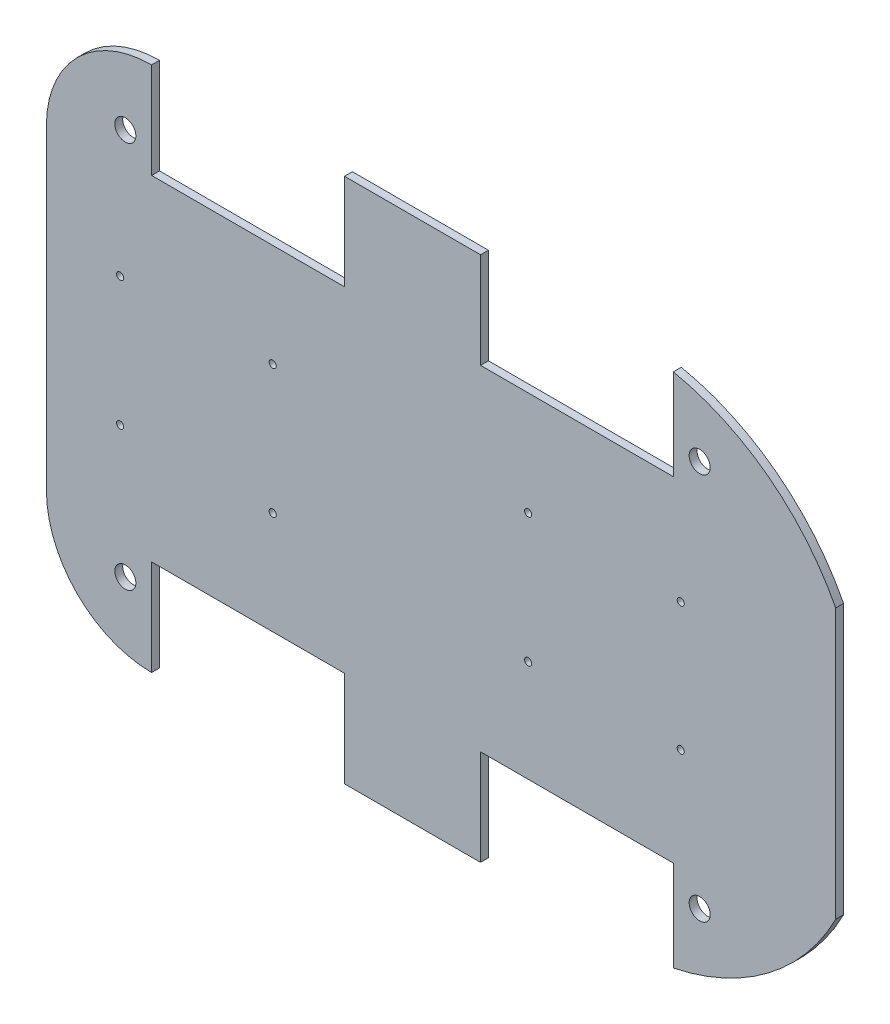
from build123d import *

# Parameters (mm, degrees)
SKETCH_1_R          = 2
SKETCH_1_W          = 15
SKETCH_1_H          = 3
EXTRUDE_1_DEPTH     = 3
CUT_EXTRUDE_1_REACH = 360.482
SKETCH_2_W          = 15
SKETCH_2_H          = 3
SKETCH_3_R          = 2
EXTRUDE_2_DEPTH     = 3
SKETCH_4_W          = 15
SKETCH_4_H          = 3
CUT_EXTRUDE_2_DEPTH = 10
EXTRUDE_START       = -3
EXTRUDE_3_DEPTH     = 3
SKETCH_10_R         = 4
CUT_EXTRUDE_3_DEPTH = 3
SKETCH_11_R         = 1.35
CUT_EXTRUDE_4_DEPTH = 3
EXTRUDE_START_2     = 4
SKETCH_12_R         = 4
SKETCH_12_R_2       = 1.35
EXTRUDE_4_DEPTH     = 4
SKETCH_13_R         = 1.35
CUT_EXTRUDE_5_DEPTH = 3
SKETCH_14_R         = 4
SKETCH_14_R_2       = 1.35
EXTRUDE_5_DEPTH     = 4
CUT_EXTRUDE_START   = -4
CUT_EXTRUDE_6_DEPTH = 4


with BuildPart() as part:
    # 草图1 → 凸台-拉伸1 (new body)
    with BuildSketch(Plane.XY.offset(3)):
        with BuildLine():
            Line((165, 0), (165, 28))
            Line((165, 28), (173, 28))
            Line((173, 28), (173, 31.7))
            Line((173, 31.7), (188, 31.7))
            Line((188, 31.7), (188, 28))
            Line((188, 28), (238.3, 28))
            Line((238.3, 28), (238.3, 1.880138448))
            ThreePointArc((238.3, 1.880138448), (310, 90), (238.3, 178.119861552))
            Line((238.3, 178.119861552), (238.3, 152))
            Line((238.3, 152), (188, 152))
            Line((188, 152), (188, 148.3))
            Line((188, 148.3), (173, 148.3))
            Line((173, 148.3), (173, 152))
            Line((173, 152), (165, 152))
            Line((165, 152), (165, 180))
            Line((165, 180), (113.3, 180))
            Line((113.3, 180), (113.3, 152))
            Line((113.3, 152), (63, 152))
            Line((63, 152), (63, 148.3))
            Line((63, 148.3), (48, 148.3))
            Line((48, 148.3), (48, 152))
            Line((48, 152), (40, 152))
            Line((40, 152), (40, 180))
            ThreePointArc((40, 180), (11.715728753, 168.284271247), (0, 140))
            Line((0, 140), (0, 40))
            ThreePointArc((0, 40), (11.715728753, 11.715728753), (40, 0))
            Line((40, 0), (40, 28))
            Line((40, 28), (48, 28))
            Line((48, 28), (48, 31.7))
            Line((48, 31.7), (63, 31.7))
            Line((63, 31.7), (63, 28))
            Line((63, 28), (113.3, 28))
            Line((113.3, 28), (113.3, 0))
            Line((113.3, 0), (165, 0))
        make_face()
        with Locations(Location((233.9, 84.9, 0), (0, 0, 180))):
            Circle(SKETCH_1_R, mode=Mode.SUBTRACT)
        with Locations(Location((186.1, 84.9, 0), (0, 0, 180))):
            Circle(SKETCH_1_R, mode=Mode.SUBTRACT)
        with Locations(Location((28, 166, 0), (0, 0, 180))):
            Circle(SKETCH_1_R, mode=Mode.SUBTRACT)
        with Locations(Location((28, 14, 0), (0, 0, 180))):
            Circle(SKETCH_1_R, mode=Mode.SUBTRACT)
        with Locations(Location((248.3, 165.059930776, 0), (0, 0, 180))):
            Circle(SKETCH_1_R, mode=Mode.SUBTRACT)
        with Locations(Location((248.3, 14.940069224, 0), (0, 0, 180))):
            Circle(SKETCH_1_R, mode=Mode.SUBTRACT)
        with Locations(Location((139.15, 14, 0), (0, 0, 180))):
            Circle(SKETCH_1_R, mode=Mode.SUBTRACT)
        with Locations(Location((139.15, 166, 0), (0, 0, 180))):
            Circle(SKETCH_1_R, mode=Mode.SUBTRACT)
        with Locations((55.5, 52)):
            Rectangle(SKETCH_1_W, SKETCH_1_H, mode=Mode.SUBTRACT)
        with Locations((180.5, 52)):
            Rectangle(SKETCH_1_W, SKETCH_1_H, mode=Mode.SUBTRACT)
        with Locations((180.5, 128)):
            Rectangle(SKETCH_1_W, SKETCH_1_H, mode=Mode.SUBTRACT)
        with Locations((55.5, 128)):
            Rectangle(SKETCH_1_W, SKETCH_1_H, mode=Mode.SUBTRACT)
    extrude(amount=-EXTRUDE_1_DEPTH)

    # 草图2 → 切除-拉伸1 (cut, up to next)
    with BuildSketch(Plane(origin=(0, 0, 0), x_dir=(-1, 0, 0), z_dir=(0, 0, -1)), mode=Mode.PRIVATE) as cut_extrude_1_sk1:
        with Locations((-55.280073226, 119.6)):
            Rectangle(SKETCH_2_W, SKETCH_2_H)
    cut_extrude_1_tool1 = extrude(cut_extrude_1_sk1.sketch, amount=-CUT_EXTRUDE_1_REACH, mode=Mode.PRIVATE) & part.part
    # 草图2 → 切除-拉伸1 (cut, up to next)
    with BuildSketch(Plane(origin=(0, 0, 0), x_dir=(-1, 0, 0), z_dir=(0, 0, -1)), mode=Mode.PRIVATE) as cut_extrude_1_sk2:
        Polygon((-48, 152), (-40, 152), (-40, 143.6), (-48, 143.6), (-48, 139.9), (-63, 139.9), (-63, 143.6), (-113.3, 143.6), (-113.3, 152), (-63, 152), (-63, 148.3), (-48, 148.3), align=None)
    cut_extrude_1_tool2 = extrude(cut_extrude_1_sk2.sketch, amount=-CUT_EXTRUDE_1_REACH, mode=Mode.PRIVATE) & part.part
    add(cut_extrude_1_tool1.solids().sort_by_distance((55.280073, 119.6, 0))[0], mode=Mode.SUBTRACT)
    add(cut_extrude_1_tool2.solids().sort_by_distance((76.65, 147.042838, 0))[0], mode=Mode.SUBTRACT)

    # 草图3 → 凸台-拉伸2 (add)
    with BuildSketch(Plane.XY.offset(3)):
        with Locations((186.1, 84.9)):
            Circle(SKETCH_3_R)
        with Locations((233.9, 84.9)):
            Circle(SKETCH_3_R)
    extrude(amount=-EXTRUDE_2_DEPTH)

    # 草图4 → 切除-拉伸2 (cut)
    with BuildSketch(Plane(origin=(0, 0, 0), x_dir=(-1, 0, 0), z_dir=(0, 0, -1))):
        with Locations((-180.685567248, 119.6)):
            Rectangle(SKETCH_4_W, SKETCH_4_H)
        Polygon((-238.3, 143.6), (-188, 143.6), (-188, 139.9), (-173, 139.9), (-173, 143.6), (-165, 143.6), (-165, 152), (-173, 152), (-173, 148.3), (-188, 148.3), (-188, 152), (-238.3, 152), align=None)
    extrude(amount=-CUT_EXTRUDE_2_DEPTH, mode=Mode.SUBTRACT)

    # Split Bodies 4
    split(bisect_by=Plane.ZX.offset(90), keep=Keep.TOP)

    # 草图9 → 凸台-拉伸3 (add)
    with BuildSketch(Plane(origin=(0, 0, 0), x_dir=(-1, 0, 0), z_dir=(0, 0, -1)).offset(EXTRUDE_START)):
        with BuildLine():
            Line((-310, 80), (0, 80))
            Line((0, 80), (0, 140))
            ThreePointArc((0, 140), (-11.715728753, 168.284271247), (-40, 180))
            Line((-40, 180), (-40, 143.6))
            Line((-40, 143.6), (-113.3, 143.6))
            Line((-113.3, 143.6), (-113.3, 180))
            Line((-113.3, 180), (-165, 180))
            Line((-165, 180), (-165, 143.6))
            Line((-165, 143.6), (-238.3, 143.6))
            Line((-238.3, 143.6), (-238.3, 178.119861552))
            ThreePointArc((-238.3, 178.119861552), (-289.810457669, 146.802288686), (-310, 90))
            Line((-310, 90), (-310, 80))
        make_face()
    extrude(amount=EXTRUDE_3_DEPTH)

    # 草图10 → 切除-拉伸3 (cut)
    with BuildSketch(Plane(origin=(0, 0, 0), x_dir=(-1, 0, 0), z_dir=(0, 0, -1))):
        with Locations((-248.3, 153.6)):
            Circle(SKETCH_10_R)
        with Locations((-30, 153.6)):
            Circle(SKETCH_10_R)
    extrude(amount=-CUT_EXTRUDE_3_DEPTH, mode=Mode.SUBTRACT)

    # 镜向2: part across plane


with BuildPart() as part_1:
    add(part.part)
    add(part.part.mirror(Plane(origin=(310, 80, 328.729949498), x_dir=(0, 0, 1), z_dir=(0, -1, 0))))

    # 草图11 → 切除-拉伸4 (cut)
    with BuildSketch(Plane(origin=(0, 0, 0), x_dir=(-1, 0, 0), z_dir=(0, 0, -1))):
        with Locations((-86.022725282, 104.5)):
            Circle(SKETCH_11_R)
        with Locations((-86.022725282, 55.5)):
            Circle(SKETCH_11_R)
        with Locations((-28.022725282, 104.5)):
            Circle(SKETCH_11_R)
        with Locations((-28.022725282, 55.5)):
            Circle(SKETCH_11_R)
    extrude(amount=-CUT_EXTRUDE_4_DEPTH, mode=Mode.SUBTRACT)

    # 草图12 → 凸台-拉伸4 (add)
    # profile 1 of 4: a face of its own
    with BuildSketch(Plane(origin=(0, 0, 0), x_dir=(-1, 0, 0), z_dir=(0, 0, -1)).offset(EXTRUDE_START_2)):
        with Locations(Location((-86.022725282, 104.5, 0), (0, 0, 180))):
            Circle(SKETCH_12_R)
        with Locations((-86.022725282, 104.5)):
            Circle(SKETCH_12_R_2, mode=Mode.SUBTRACT)
    # profile 2 of 4: a face of its own
    with BuildSketch(Plane(origin=(0, 0, 0), x_dir=(-1, 0, 0), z_dir=(0, 0, -1)).offset(EXTRUDE_START_2)):
        with Locations(Location((-28.022725282, 104.5, 0), (0, 0, 180))):
            Circle(SKETCH_12_R)
        with Locations((-28.022725282, 104.5)):
            Circle(SKETCH_12_R_2, mode=Mode.SUBTRACT)
    # profile 3 of 4: a face of its own
    with BuildSketch(Plane(origin=(0, 0, 0), x_dir=(-1, 0, 0), z_dir=(0, 0, -1)).offset(EXTRUDE_START_2)):
        with Locations(Location((-28.022725282, 55.5, 0), (0, 0, 180))):
            Circle(SKETCH_12_R)
        with Locations((-28.022725282, 55.5)):
            Circle(SKETCH_12_R_2, mode=Mode.SUBTRACT)
    # profile 4 of 4: a face of its own
    with BuildSketch(Plane(origin=(0, 0, 0), x_dir=(-1, 0, 0), z_dir=(0, 0, -1)).offset(EXTRUDE_START_2)):
        with Locations(Location((-86.022725282, 55.5, 0), (0, 0, 180))):
            Circle(SKETCH_12_R)
        with Locations((-86.022725282, 55.5)):
            Circle(SKETCH_12_R_2, mode=Mode.SUBTRACT)
    extrude(amount=-EXTRUDE_4_DEPTH)

    # 草图13 → 切除-拉伸5 (cut)
    with BuildSketch(Plane(origin=(0, 0, 0), x_dir=(-1, 0, 0), z_dir=(0, 0, -1))):
        with Locations((-183.092928671, 55.103896104)):
            Circle(SKETCH_13_R)
        with Locations((-183.092928671, 104.103896104)):
            Circle(SKETCH_13_R)
        with Locations((-241.09213252, 103.8)):
            Circle(SKETCH_13_R)
        with Locations((-241.092928671, 55.103896104)):
            Circle(SKETCH_13_R)
    extrude(amount=-CUT_EXTRUDE_5_DEPTH, mode=Mode.SUBTRACT)

    # 草图14 → 凸台-拉伸5 (add)
    # profile 1 of 4: a face of its own
    with BuildSketch(Plane(origin=(0, 0, 0), x_dir=(-1, 0, 0), z_dir=(0, 0, -1)).offset(EXTRUDE_START_2)):
        with Locations(Location((-241.09213252, 103.8, 0), (0, 0, 180))):
            Circle(SKETCH_14_R)
        with Locations((-241.09213252, 103.8)):
            Circle(SKETCH_14_R_2, mode=Mode.SUBTRACT)
    # profile 2 of 4: a face of its own
    with BuildSketch(Plane(origin=(0, 0, 0), x_dir=(-1, 0, 0), z_dir=(0, 0, -1)).offset(EXTRUDE_START_2)):
        with Locations(Location((-183.092928671, 104.103896104, 0), (0, 0, 180))):
            Circle(SKETCH_14_R)
        with Locations((-183.092928671, 104.103896104)):
            Circle(SKETCH_14_R_2, mode=Mode.SUBTRACT)
    # profile 3 of 4: a face of its own
    with BuildSketch(Plane(origin=(0, 0, 0), x_dir=(-1, 0, 0), z_dir=(0, 0, -1)).offset(EXTRUDE_START_2)):
        with Locations(Location((-241.092928671, 55.103896104, 0), (0, 0, 180))):
            Circle(SKETCH_14_R)
        with Locations((-241.092928671, 55.103896104)):
            Circle(SKETCH_14_R_2, mode=Mode.SUBTRACT)
    # profile 4 of 4: a face of its own
    with BuildSketch(Plane(origin=(0, 0, 0), x_dir=(-1, 0, 0), z_dir=(0, 0, -1)).offset(EXTRUDE_START_2)):
        with Locations(Location((-183.092928671, 55.103896104, 0), (0, 0, 180))):
            Circle(SKETCH_14_R)
        with Locations((-183.092928671, 55.103896104)):
            Circle(SKETCH_14_R_2, mode=Mode.SUBTRACT)
    extrude(amount=-EXTRUDE_5_DEPTH)

    # 草图15 → 切除-拉伸6 (cut)
    with BuildSketch(Plane(origin=(0, 0, 0), x_dir=(-1, 0, 0), z_dir=(0, 0, -1)).offset(CUT_EXTRUDE_START)):
        with BuildLine():
            Line((-300, 131.231056256), (-300, 28.768943744))
            ThreePointArc((-300, 28.768943744), (-307.464278423, 48.786796564), (-310, 70))
            Line((-310, 70), (-310, 90))
            ThreePointArc((-310, 90), (-307.464278423, 111.213203436), (-300, 131.231056256))
        make_face()
    extrude(amount=CUT_EXTRUDE_6_DEPTH, mode=Mode.SUBTRACT)


solid = part_1.part
